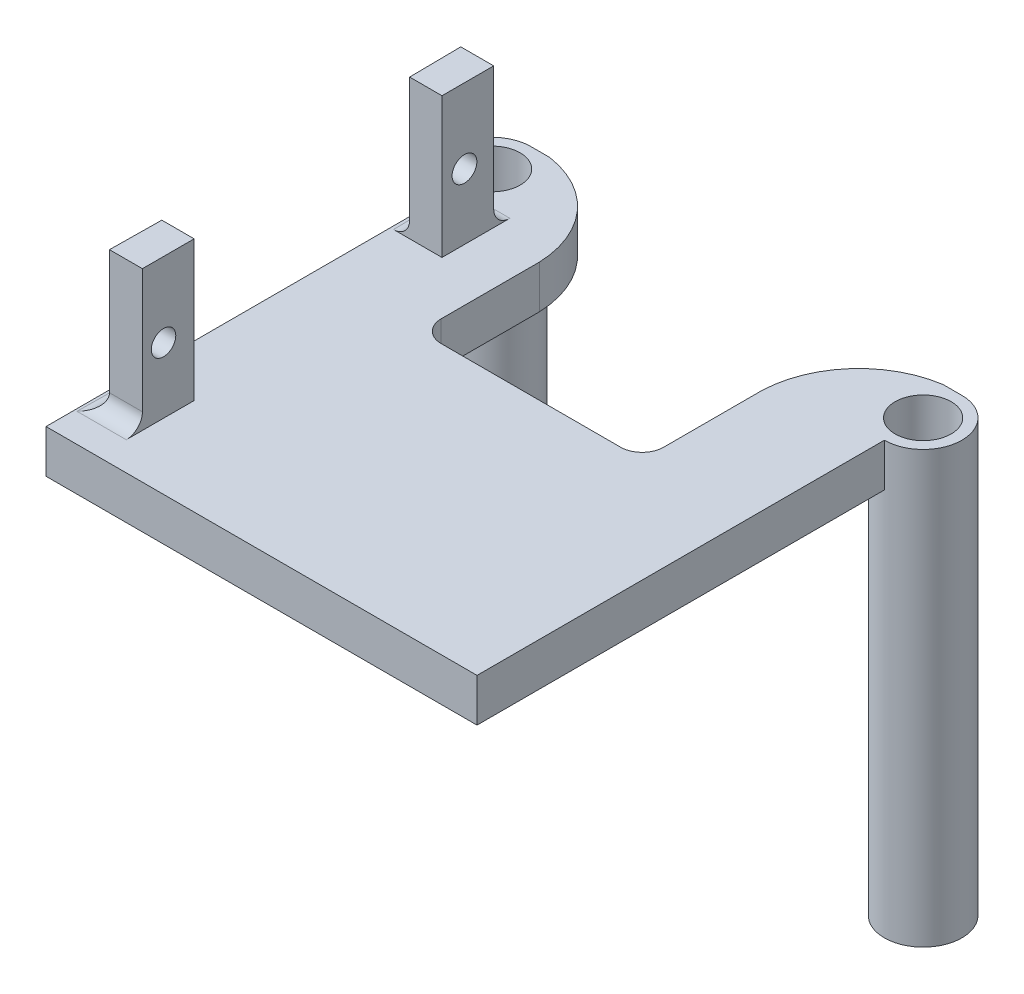
from build123d import *

# Parameters (mm, degrees)
SKETCH1_R             = 3.6
SKETCH1_R_2           = 2.6
BOSS_EXTRUDE1_DEPTH   = 40
BOSS_EXTRUDE1_2_DEPTH = 40
BOSS_EXTRUDE2_START   = -4
BOSS_EXTRUDE2_DEPTH   = 4
SKETCH4_W             = 20.645
SKETCH4_H             = 20
CUT_EXTRUDE2_DEPTH    = 10
BOSS_EXTRUDE3_DEPTH   = 13
FILLET3_R             = 1.5
SKETCH6_R             = 1.135575656
SKETCH6_R_2           = 1.15
CUT_EXTRUDE3_DEPTH    = 13
FILLET4_R             = 2
SKETCH9_R             = 2.851630117
SKETCH9_R_2           = 1.6
BOSS_EXTRUDE4_DEPTH   = 2
SKETCH10_R            = 2.895791365
SKETCH10_R_2          = 1.6
BOSS_EXTRUDE5_DEPTH   = 4
CUT_EXTRUDE4_DEPTH    = 10


with BuildPart() as part:
    # Sketch1 → Boss-Extrude1 (new body)
    with BuildSketch(Plane(origin=(0, 0, 0), x_dir=(1, 0, 0), z_dir=(0, 1, 0))):
        with Locations(Location((-16.334138417, 4.403985818, 0), (0, 0, 270))):
            Circle(SKETCH1_R)
        with Locations(Location((-16.334138417, 4.403985818, 0), (0, 0, 270))):
            Circle(SKETCH1_R_2, mode=Mode.SUBTRACT)
    extrude(amount=BOSS_EXTRUDE1_DEPTH)



with BuildPart() as body_2:
    # Sketch1 → Boss-Extrude1 2 (new body)
    with BuildSketch(Plane(origin=(0, 0, 0), x_dir=(1, 0, 0), z_dir=(0, 1, 0))):
        with Locations(Location((23.665861583, 4.403985818, 0), (0, 0, 270))):
            Circle(SKETCH1_R)
        with Locations(Location((23.665861583, 4.403985818, 0), (0, 0, 270))):
            Circle(SKETCH1_R_2, mode=Mode.SUBTRACT)
    extrude(amount=BOSS_EXTRUDE1_2_DEPTH)


with BuildPart() as part_1:
    add(part.part)

    add(body_2.part)  # Boss-Extrude2 merges body 2
    # Sketch2 → Boss-Extrude2 (add)
    with BuildSketch(Plane(origin=(0, 40, 0), x_dir=(1, 0, 0), z_dir=(0, 1, 0)).offset(BOSS_EXTRUDE2_START)):
        with BuildLine():
            Line((-16.334138417, 8.003985818), (23.665861583, 8.003985818))
            ThreePointArc((23.665861583, 8.003985818), (20.065861583, 4.403985818), (23.665861583, 0.803985818))
            Line((23.665861583, 0.803985818), (23.665861583, -36.996014182))
            Line((23.665861583, -36.996014182), (-16.334138417, -36.996014182))
            Line((-16.334138417, -36.996014182), (-16.334138417, 0.803985818))
            ThreePointArc((-16.334138417, 0.803985818), (-12.734138417, 4.403985818), (-16.334138417, 8.003985818))
        make_face()
    extrude(amount=BOSS_EXTRUDE2_DEPTH)

    # Sketch4 → Cut-Extrude2 (cut)
    with BuildSketch(Plane(origin=(0, 40, 0), x_dir=(1, 0, 0), z_dir=(0, 1, 0))):
        with Locations((3.665861583, -1.996014182)):
            Rectangle(SKETCH4_W, SKETCH4_H)
    extrude(amount=-CUT_EXTRUDE2_DEPTH, mode=Mode.SUBTRACT)

    # Sketch5 → Boss-Extrude3 (add)
    with BuildSketch(Plane(origin=(0, 40, 0), x_dir=(1, 0, 0), z_dir=(0, 1, 0))):
        Polygon((-11.546638417, -5.036014182), (-14.546638417, -5.036014182), (-14.603209007, -0.236014182), (-11.546638417, -0.236014182), align=None)
        Polygon((-14.546638417, -28.036014182), (-11.546638417, -28.036014182), (-11.546638417, -32.836014182), (-14.603209007, -32.836014182), align=None)
    extrude(amount=BOSS_EXTRUDE3_DEPTH)

    # Fillet3
    fillet3_edges = [part_1.edges().sort_by_distance(p)[0] for p in [
        (-13.074923712, 40, 32.836014182),
        (-14.574923712, 40, 30.436014182),
        (-13.074923712, 40, 0.236014182),
        (-14.574923712, 40, 2.636014182),
    ]]
    fillet(fillet3_edges, radius=FILLET3_R)

    # Sketch6 → Cut-Extrude3 (cut)
    with BuildSketch(Plane(origin=(-11.546638417, 0.245033675, 0.24921506), x_dir=(0, 0, -1), z_dir=(1, 0, 0))):
        with Locations((-30.626521838, 45.832462835)):
            Circle(SKETCH6_R)
        with Locations((-2.699312308, 45.832462835)):
            Circle(SKETCH6_R_2)
    extrude(amount=-CUT_EXTRUDE3_DEPTH, mode=Mode.SUBTRACT)

    # Fillet4
    fillet4_edges = [part_1.edges().sort_by_distance(p)[0] for p in [
        (-6.656638417, 38, 11.996014182),
        (-6.656638417, 38, -8.003985818),
        (13.988361583, 38, -8.003985818),
        (13.988361583, 38, 11.996014182),
    ]]
    fillet(fillet4_edges, radius=FILLET4_R)

    # Sketch9 → Boss-Extrude4 (add)
    with BuildSketch(Plane.XZ):
        with Locations((-16.334138417, -4.403985818)):
            Circle(SKETCH9_R)
        with Locations(Location((-16.334138417, -4.403985818, 0), (0, 0, 270))):
            Circle(SKETCH9_R_2, mode=Mode.SUBTRACT)
    extrude(amount=-BOSS_EXTRUDE4_DEPTH)

    # Sketch10 → Boss-Extrude5 (add)
    with BuildSketch(Plane.XZ):
        with Locations((23.665861583, -4.403985818)):
            Circle(SKETCH10_R)
        with Locations(Location((23.665861583, -4.403985818, 0), (0, 0, 270))):
            Circle(SKETCH10_R_2, mode=Mode.SUBTRACT)
    extrude(amount=-BOSS_EXTRUDE5_DEPTH)

    # Sketch12 → Cut-Extrude4 (cut)
    with BuildSketch(Plane(origin=(0, 40, 0), x_dir=(1, 0, 0), z_dir=(0, 1, 0))):
        with BuildLine():
            Line((-14.597154628, 8.003985818), (-6.526218466, 8.003985818))
            Line((-6.526218466, 8.003985818), (-6.656638417, -0.894717181))
            ThreePointArc((-6.656638417, -0.894717181), (-9.013941955, 4.99391057), (-14.597154628, 8.003985818))
        make_face()
    cut_extrude4 = extrude(amount=-CUT_EXTRUDE4_DEPTH, mode=Mode.SUBTRACT)

    # Mirror1: Cut-Extrude4 across plane
    add(cut_extrude4.mirror(Plane.ZY.offset(-3.665861583)), mode=Mode.SUBTRACT)


solid = part_1.part
